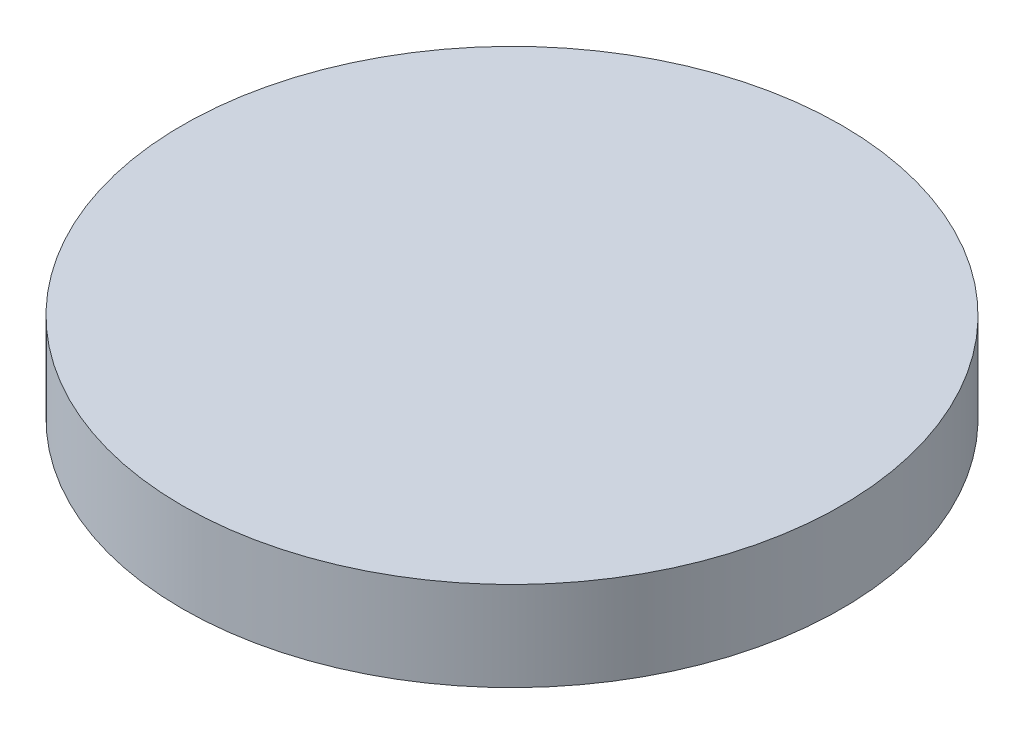
from build123d import *

# Parameters (mm, degrees)
SKETCH1_R           = 36.897090419
BOSS_EXTRUDE1_DEPTH = 10
SHELL1_T            = -2


with BuildPart() as part:
    # Sketch1 → Boss-Extrude1 (new body)
    with BuildSketch(Plane(origin=(0, 0, 0), x_dir=(1, 0, 0), z_dir=(0, 1, 0))):
        with Locations(Location((0, 0, 0), (0, 0, 270))):
            Circle(SKETCH1_R)
    extrude(amount=BOSS_EXTRUDE1_DEPTH)

    # Shell1
    shell1_openings = [part.faces().sort_by_distance(p)[0] for p in [
        (0, 0, 0),
    ]]
    offset(amount=SHELL1_T, openings=shell1_openings, kind=Kind.INTERSECTION)


solid = part.part
